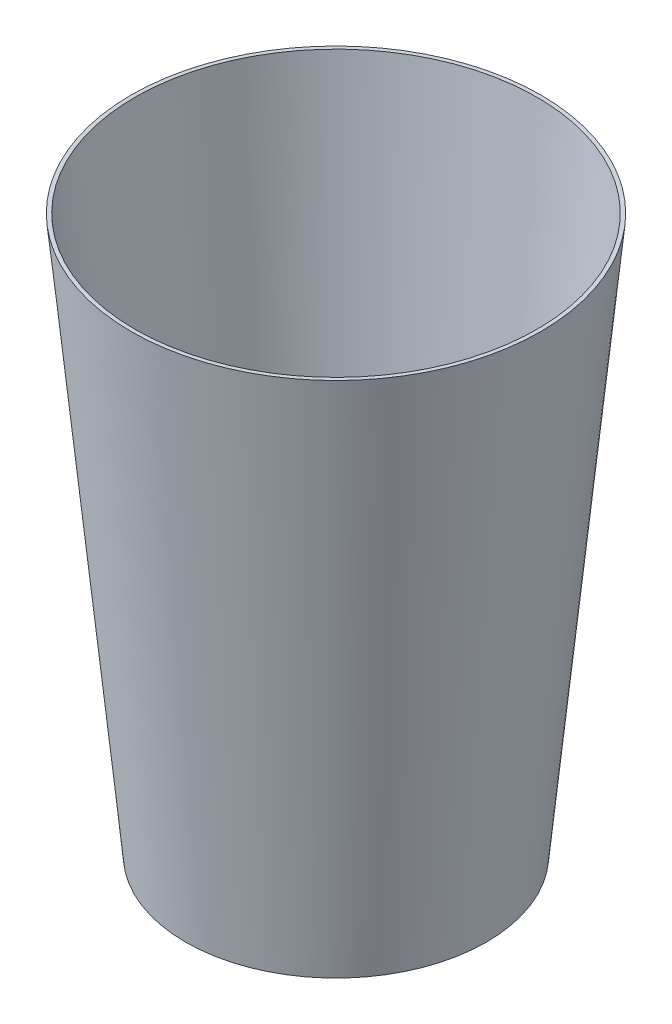
from build123d import *

# Parameters (mm, degrees)
SKETCH1_R           = 35
BOSS_EXTRUDE1_DEPTH = 95
BOSS_EXTRUDE1_DRAFT = -5.588
SKETCH3_R           = 34.35
CUT_EXTRUDE1_DEPTH  = 94.35
CUT_EXTRUDE1_DRAFT  = -5.588


with BuildPart() as part:
    # Sketch1 → Boss-Extrude1 (with draft: the straight prism first)
    with BuildSketch(Plane(origin=(0, 0, 0), x_dir=(1, 0, 0), z_dir=(0, 1, 0))):
        Circle(SKETCH1_R)
    extrude(amount=-BOSS_EXTRUDE1_DEPTH)
    # Boss-Extrude1: the draft: its side faces are tilted about the plane it starts from
    boss_extrude1_sides = [part.faces().sort_by_distance(p)[0] for p in [
        (-35, -47.5, 0),
    ]]
    draft(boss_extrude1_sides, Plane(origin=(0, 0, 0), x_dir=(1, 0, 0), z_dir=(0, 1, 0)), BOSS_EXTRUDE1_DRAFT)


with BuildPart() as cut_extrude1_tool:
    # Sketch3 → Cut-Extrude1 (with draft: the straight prism first)
    with BuildSketch(Plane(origin=(0, 0, 0), x_dir=(1, 0, 0), z_dir=(0, 1, 0))):
        Circle(SKETCH3_R)
    extrude(amount=-CUT_EXTRUDE1_DEPTH)
    # Cut-Extrude1: the draft: its side faces are tilted about the plane it starts from
    cut_extrude1_sides = [cut_extrude1_tool.faces().sort_by_distance(p)[0] for p in [
        (-34.35, -47.175, 0),
    ]]
    draft(cut_extrude1_sides, Plane(origin=(0, 0, 0), x_dir=(1, 0, 0), z_dir=(0, 1, 0)), CUT_EXTRUDE1_DRAFT)


with BuildPart() as part_1:
    add(part.part)

    # Cut-Extrude1: cut by cut_extrude1_tool
    add(cut_extrude1_tool.part, mode=Mode.SUBTRACT)


solid = part_1.part
